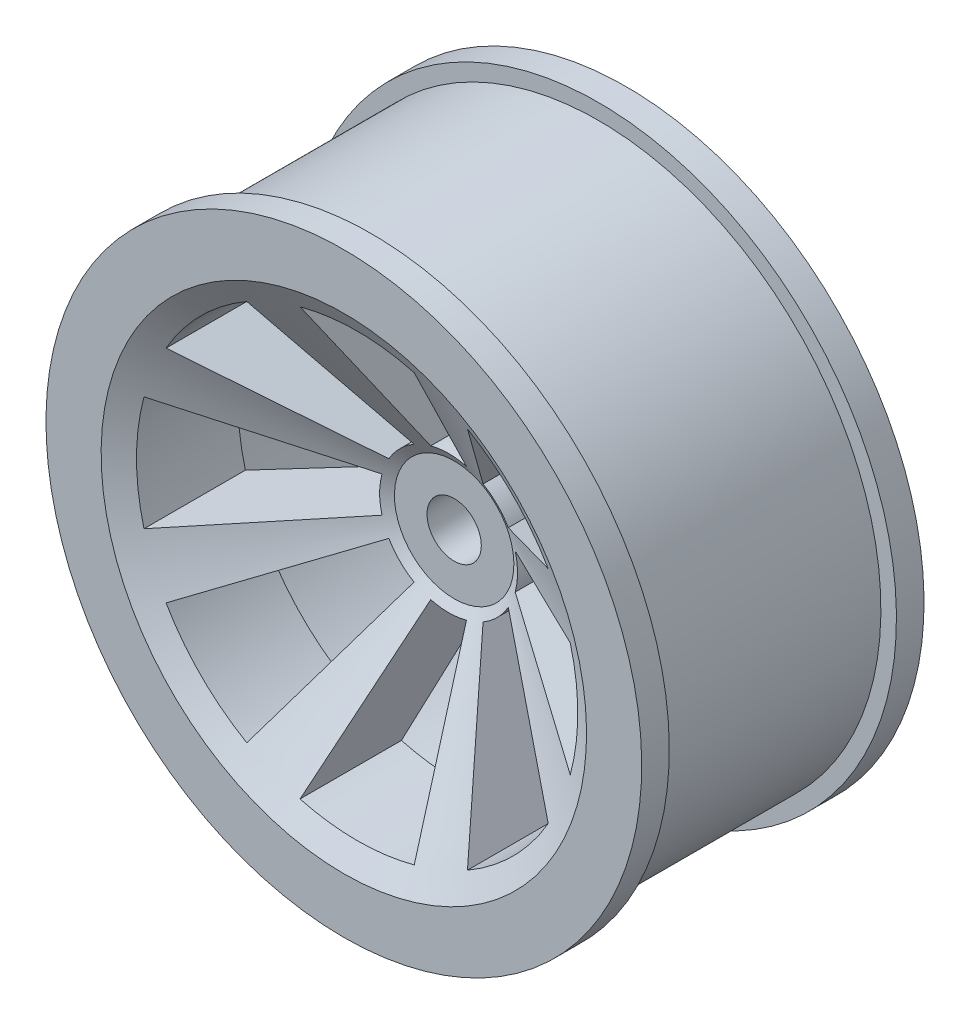
from build123d import *

# Parameters (mm, degrees)
CUT_EXTRUDE1_REACH = 48.701
CIRPATTERN1_COUNT  = 8
CHAMFER1_SIZE      = 2.54
CUT_EXTRUDE2_REACH = 43.904
SKETCH3_R          = 2.5


with BuildPart() as part:
    # Sketch1 → Revolve1 (revolve)
    with BuildSketch(Plane(origin=(0, 0, 0), x_dir=(0, 0, -1), z_dir=(1, 0, 0)), mode=Mode.PRIVATE) as revolve1_sk:
        Polygon((-6.61, 0), (1.61, 0), (1.61, 2.6), (1.61, 5.5), (-7.28, 22.352), (9.23, 22.352), (9.23, 27.432), (6.69, 27.432), (6.69, 26), (-14.23, 26), (-14.23, 27.432), (-16.77, 27.432), (-16.77, 22.352), (-6.61, 5.5), align=None)
    revolve(revolve1_sk.sketch.rotate(Axis((0, 0, 6.61), (0, 0, -1)), 180), axis=Axis((0, 0, 6.61), (0, 0, -1)))

    # Cut-Extrude1: up to this cone (the profile starts inside it)
    cut_extrude1_end = Plane(origin=(0, 0, 16.77), z_dir=(0, 0, 1)).offset(-21.281435031) * Cone(1.896e-06, 210.079048668, 110.82380286, align=(Align.CENTER, Align.CENTER, Align.MIN), mode=Mode.PRIVATE)
    # Sketch2 → Cut-Extrude1 (cut, up to the surface)
    with BuildSketch(Plane.XY.offset(16.77), mode=Mode.PRIVATE) as cut_extrude1_sk1:
        with BuildLine():
            Line((-5.259202996, 19.62761279), (-1.643500936, 6.133628997))
            ThreePointArc((-1.643500936, 6.133628997), (0, 6.35), (1.643500936, 6.133628997))
            Line((1.643500936, 6.133628997), (5.259202996, 19.62761279))
            ThreePointArc((5.259202996, 19.62761279), (0, 20.32), (-5.259202996, 19.62761279))
        make_face()
    cut_extrude1_tool1 = extrude(cut_extrude1_sk1.sketch, amount=-CUT_EXTRUDE1_REACH, mode=Mode.PRIVATE) & cut_extrude1_end
    cut_extrude1 = cut_extrude1_tool1.solids().sort_by_distance((0, 14.388913, 16.77))[0]
    add(cut_extrude1, mode=Mode.SUBTRACT)

    # CirPattern1: Cut-Extrude1 ×8 about axis
    cirpattern1_axis = Axis((0, 0, 0), (0, 0, 1))
    for i in range(1, CIRPATTERN1_COUNT):
        add(cut_extrude1.rotate(cirpattern1_axis, i * 360 / CIRPATTERN1_COUNT), mode=Mode.SUBTRACT)

    # Chamfer1
    chamfer1_edges = [part.edges().sort_by_distance(p)[0] for p in [
        (0, 22.352, -9.23),
    ]]
    chamfer(chamfer1_edges, length=CHAMFER1_SIZE)

    # Sketch3 → Cut-Extrude2 (cut, up to next)
    with BuildSketch(Plane.XY.offset(6.61), mode=Mode.PRIVATE) as cut_extrude2_sk1:
        Circle(SKETCH3_R)
    cut_extrude2_tool1 = extrude(cut_extrude2_sk1.sketch, amount=-CUT_EXTRUDE2_REACH, mode=Mode.PRIVATE) & part.part
    add(cut_extrude2_tool1.solids().sort_by_distance((0, 0, 6.61))[0], mode=Mode.SUBTRACT)


solid = part.part
